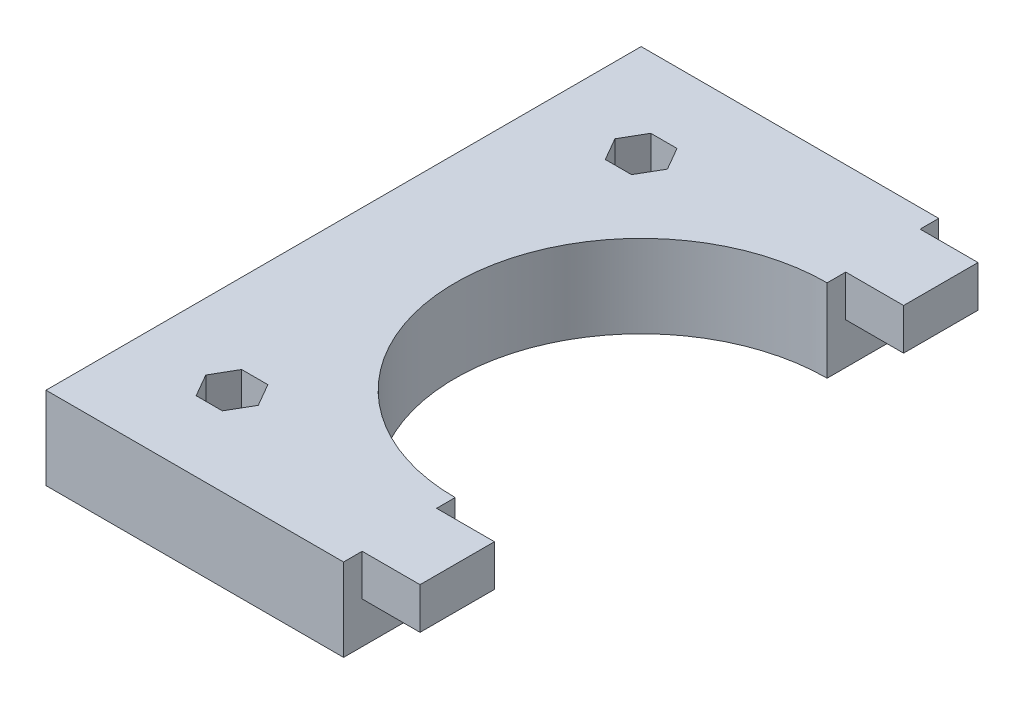
from build123d import *

# Parameters (mm, degrees)
BOSS_EXTRUDE1_DEPTH      = 5
BOSS_EXTRUDE1_DEPTH_BACK = 5
SKETCH1_R                = 1.5
CUT_EXTRUDE1_DEPTH       = 5
SKETCH3_W                = 7
SKETCH3_H                = 9
BOSS_EXTRUDE2_DEPTH      = 5


with BuildPart() as part:
    # Sketch1 → Boss-Extrude1 (new, two sides: drawn at the far end of the back side and taken through both)
    with BuildSketch(Plane(origin=(0, 0, 0), x_dir=(1, 0, 0), z_dir=(0, 1, 0)).offset(-BOSS_EXTRUDE1_DEPTH_BACK)):
        with BuildLine():
            Line((0, 22.5), (0, 36))
            Line((0, 36), (-36, 36))
            Line((-36, 36), (-36, -36))
            Line((-36, -36), (0, -36))
            Line((0, -36), (0, -22.5))
            ThreePointArc((0, -22.5), (-22.5, 0), (0, 22.5))
        make_face()
        with Locations((-24.748737342, -24.748737342)):
            Circle(SKETCH1_R, mode=Mode.SUBTRACT)
        with Locations((-24.748737342, 24.748737342)):
            Circle(SKETCH1_R, mode=Mode.SUBTRACT)
    extrude(amount=BOSS_EXTRUDE1_DEPTH + BOSS_EXTRUDE1_DEPTH_BACK)

    # Sketch2 → Cut-Extrude1 (cut)
    with BuildSketch(Plane(origin=(0, 5, 0), x_dir=(1, 0, 0), z_dir=(0, 1, 0))):
        Polygon((-23.161024101, 27.498737342), (-26.336450582, 27.498737342), (-27.924163822, 24.748737342), (-26.336450582, 21.998737342), (-23.161024101, 21.998737342), (-21.573310861, 24.748737342), align=None)
    cut_extrude1 = extrude(amount=-CUT_EXTRUDE1_DEPTH, mode=Mode.SUBTRACT)

    # Mirror1: Cut-Extrude1 across plane
    add(cut_extrude1.mirror(Plane.XY), mode=Mode.SUBTRACT)

    # Sketch3 → Boss-Extrude2 (add)
    with BuildSketch(Plane(origin=(0, 5, 0), x_dir=(1, 0, 0), z_dir=(0, 1, 0))):
        with Locations((3.5, -29.25)):
            Rectangle(SKETCH3_W, SKETCH3_H)
    boss_extrude2 = extrude(amount=-BOSS_EXTRUDE2_DEPTH)

    # Mirror2: Boss-Extrude2 across plane
    add(boss_extrude2.mirror(Plane.XY))


solid = part.part
